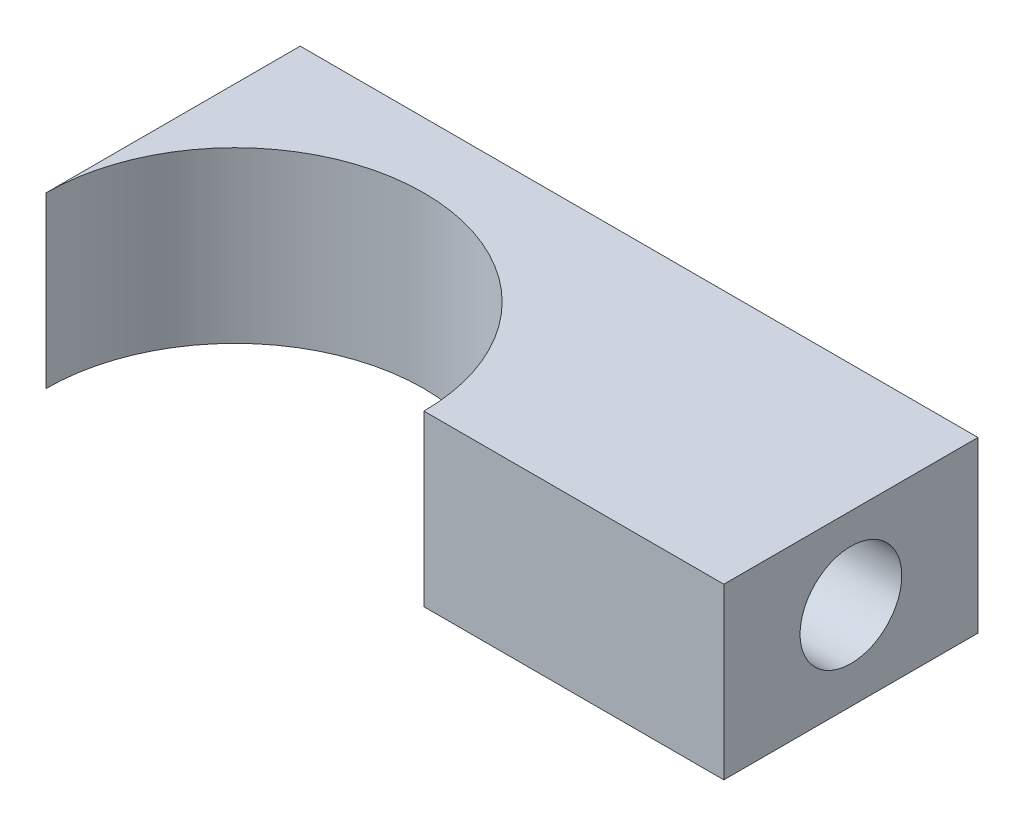
from build123d import *

# Parameters (mm, degrees)
IZIM1_W                     = 40
IZIM1_H                     = 15
Y_KSEKLIK_EKSTR_ZYON1_DEPTH = 10
IZIM2_R                     = 3
KES_EKSTR_ZYON1_DEPTH       = 10
IZIM4_R                     = 11.15
KES_EKSTR_ZYON2_DEPTH       = 10


with BuildPart() as part:
    # Çizim1 → Yükseklik-Ekstrüzyon1 (new body)
    with BuildSketch(Plane(origin=(0, 0, 0), x_dir=(1, 0, 0), z_dir=(0, 1, 0))):
        Rectangle(IZIM1_W, IZIM1_H)
    extrude(amount=Y_KSEKLIK_EKSTR_ZYON1_DEPTH)

    # Çizim2 → Kes-Ekstrüzyon1 (cut)
    with BuildSketch(Plane(origin=(20, 0, 0), x_dir=(0, 0, -1), z_dir=(1, 0, 0))):
        with Locations((0, 5.193163971)):
            Circle(IZIM2_R)
    extrude(amount=-KES_EKSTR_ZYON1_DEPTH, mode=Mode.SUBTRACT)

    # Çizim4 → Kes-Ekstrüzyon2 (cut)
    with BuildSketch(Plane(origin=(0, 10, 0), x_dir=(1, 0, 0), z_dir=(0, 1, 0))):
        with Locations((-8.85, -7.5)):
            Circle(IZIM4_R)
    extrude(amount=-KES_EKSTR_ZYON2_DEPTH, mode=Mode.SUBTRACT)


solid = part.part
